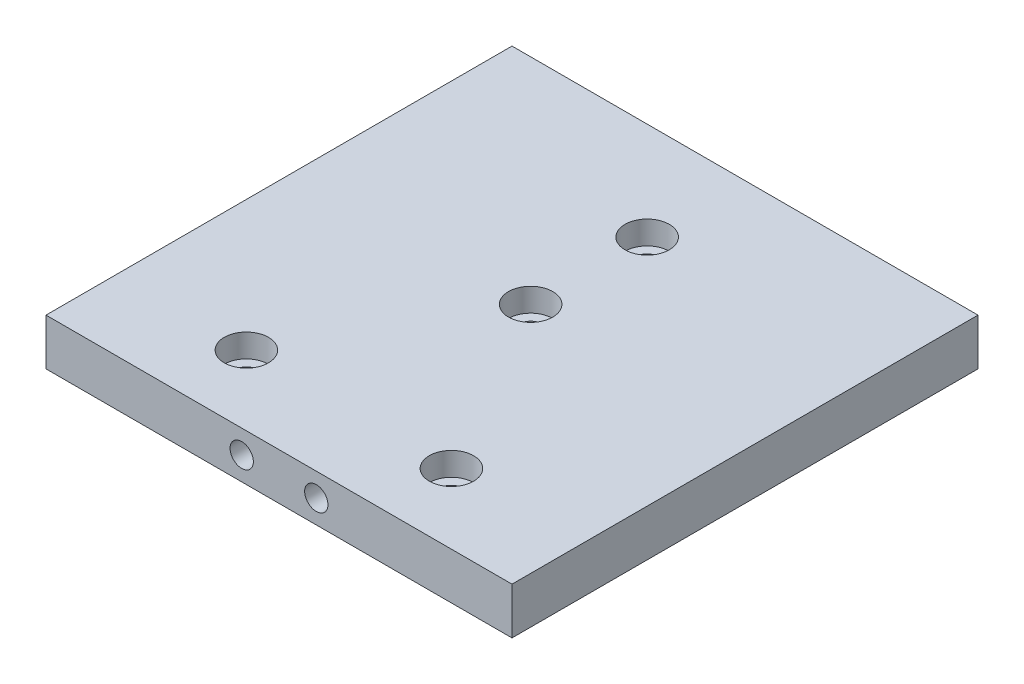
from build123d import *

# Parameters (mm, degrees)
SKETCH_1_W                   = 100
SKETCH_1_H                   = 100
EXTRUDE_1_DEPTH              = 10
HOLE_WIZARD_M2_1_D           = 3
HOLE_WIZARD_M2_1_DEPTH       = 70
HOLE_WIZARD_M2_1_CBORE_D     = 5
HOLE_WIZARD_M2_1_CBORE_DEPTH = 10
HOLE_WIZARD_M5_1_D           = 5.3
HOLE_WIZARD_M5_1_CBORE_D     = 9.5
HOLE_WIZARD_M5_1_CBORE_DEPTH = 5
HOLE_WIZARD_M2_2_D           = 2
HOLE_WIZARD_M2_2_DEPTH       = 8


with BuildPart() as part:
    # 스케치1 → 보스-돌출1 (new body)
    with BuildSketch(Plane(origin=(0, 0, 0), x_dir=(1, 0, 0), z_dir=(0, 1, 0))):
        Rectangle(SKETCH_1_W, SKETCH_1_H)
    extrude(amount=EXTRUDE_1_DEPTH)

    # M2 소켓 머리 캡 나사용 카운터보어1
    with Locations(Plane.XY.offset(50)):
        with Locations((-8, 5), (8, 5)):
            CounterBoreHole(HOLE_WIZARD_M2_1_D / 2, HOLE_WIZARD_M2_1_CBORE_D / 2, HOLE_WIZARD_M2_1_CBORE_DEPTH, depth=HOLE_WIZARD_M2_1_DEPTH)

    # M5 소켓 머리 캡 나사용 카운터보어1 (through all)
    with Locations(Plane(origin=(0, 10, 0), x_dir=(1, 0, 0), z_dir=(0, 1, 0))):
        with Locations((0, 29), (0, 4), (-22, -35), (22, -35)):
            CounterBoreHole(HOLE_WIZARD_M5_1_D / 2, HOLE_WIZARD_M5_1_CBORE_D / 2, HOLE_WIZARD_M5_1_CBORE_DEPTH)

    # M2 여유 구멍2
    with Locations(Plane(origin=(0, 0, 0), x_dir=(-1, 0, 0), z_dir=(0, -1, 0))):
        with Locations((-8, -35), (8, -35), (8, 16.5), (-8, 16.5)):
            Hole(HOLE_WIZARD_M2_2_D / 2, depth=HOLE_WIZARD_M2_2_DEPTH)


solid = part.part
